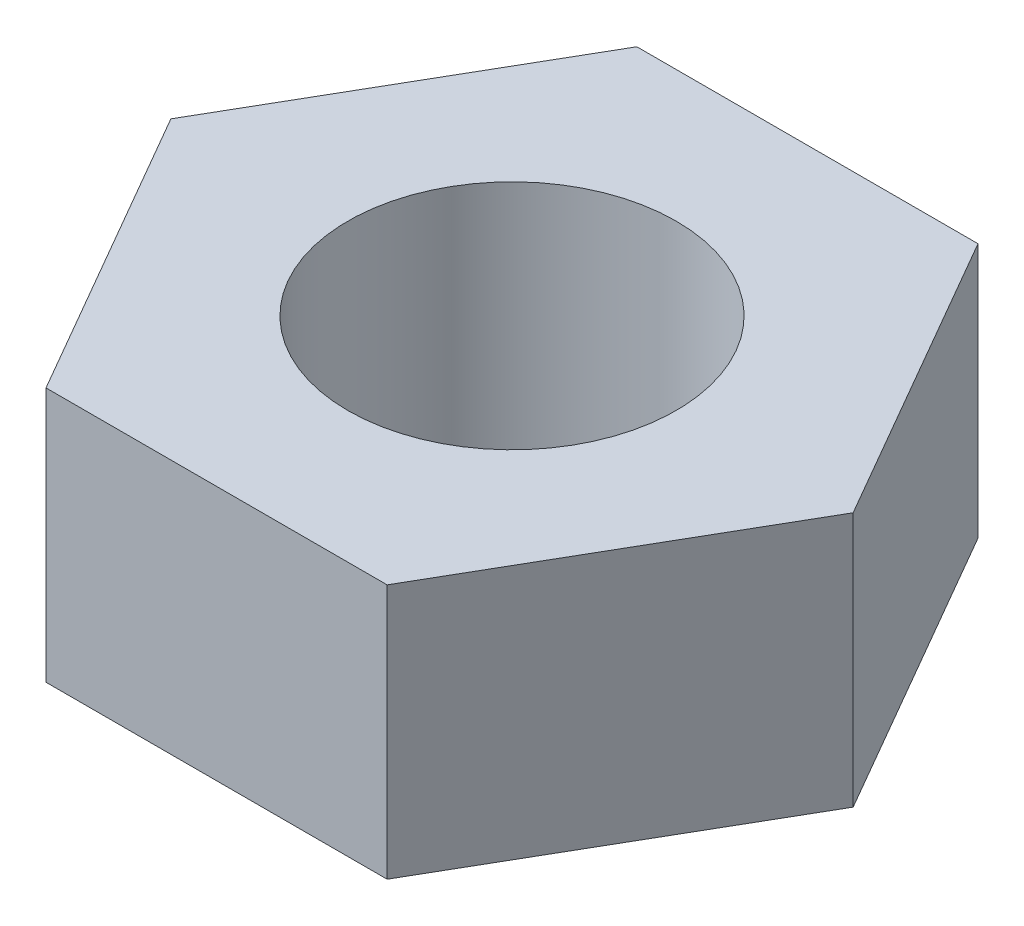
from build123d import *

# Parameters (mm, degrees)
BOSS_EXTRUDE1_DEPTH = 2.33
SKETCH2_R           = 1.5
CUT_EXTRUDE1_DEPTH  = 3


with BuildPart() as part:
    # Sketch1 → Boss-Extrude1 (new body)
    with BuildSketch(Plane(origin=(0, 0, 0), x_dir=(1, 0, 0), z_dir=(0, 1, 0))):
        Polygon((3.117691454, 0), (1.558845727, 2.7), (-1.558845727, 2.7), (-3.117691454, 0), (-1.558845727, -2.7), (1.558845727, -2.7), align=None)
    extrude(amount=BOSS_EXTRUDE1_DEPTH)

    # Sketch2 → Cut-Extrude1 (cut)
    with BuildSketch(Plane(origin=(0, 2.33, 0), x_dir=(1, 0, 0), z_dir=(0, 1, 0))):
        with Locations(Location((0, 0, 0), (0, 0, 270))):
            Circle(SKETCH2_R)
    extrude(amount=-CUT_EXTRUDE1_DEPTH, mode=Mode.SUBTRACT)


solid = part.part
